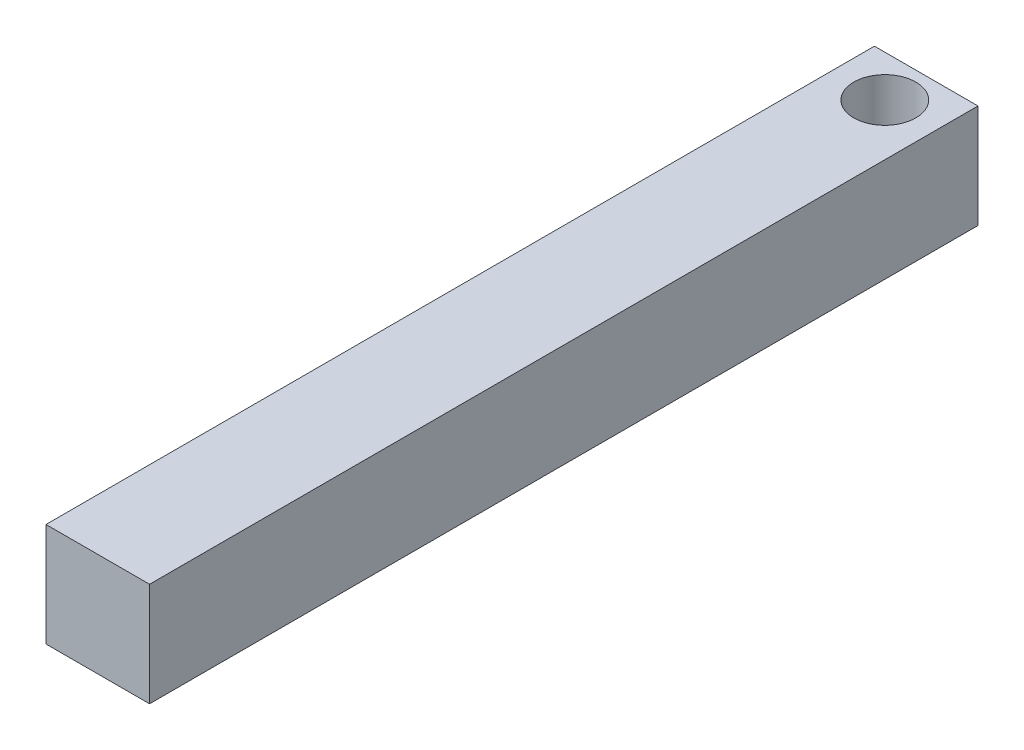
from build123d import *

# Parameters (mm, degrees)
SKETCH1_W           = 20
SKETCH1_H           = 20
BOSS_EXTRUDE1_DEPTH = 160
SKETCH2_R           = 6
CUT_EXTRUDE1_DEPTH  = 100


with BuildPart() as part:
    # Sketch1 → Boss-Extrude1 (new body)
    with BuildSketch(Plane.XY):
        Rectangle(SKETCH1_W, SKETCH1_H)
    extrude(amount=BOSS_EXTRUDE1_DEPTH)

    # Sketch2 → Cut-Extrude1 (cut)
    with BuildSketch(Plane(origin=(0, 10, 0), x_dir=(1, 0, 0), z_dir=(0, 1, 0))):
        with Locations(Location((0, -8, 0), (0, 0, 270))):
            Circle(SKETCH2_R)
    extrude(amount=-CUT_EXTRUDE1_DEPTH, mode=Mode.SUBTRACT)


solid = part.part
